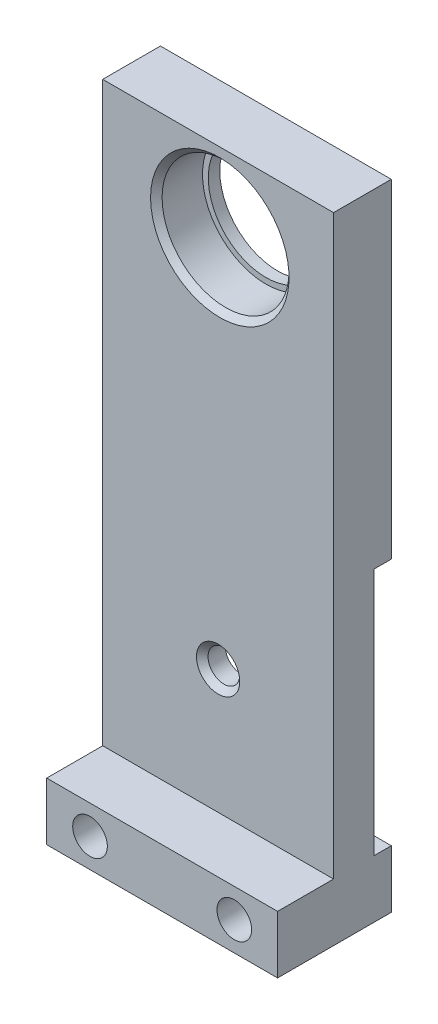
from build123d import *

# Parameters (mm, degrees)
SKIZZE1_W                       = 40
SKIZZE1_H                       = 110
AUFSATZ_LINEAR_AUSTRAGEN1_DEPTH = 10
SKIZZE2_W                       = 40
SKIZZE2_H                       = 43
SCHNITT_LINEAR_AUSTRAGEN1_DEPTH = 3
SKIZZE3_R                       = 2.75
SCHNITT_LINEAR_AUSTRAGEN2_DEPTH = 11
SKIZZE5_R                       = 11
SCHNITT_LINEAR_AUSTRAGEN4_DEPTH = 8
SKIZZE6_R                       = 10
SCHNITT_LINEAR_AUSTRAGEN5_DEPTH = 8
FASE1_SIZE                      = 1
SKIZZE10_W                      = 40
SKIZZE10_H                      = 10
AUFSATZ_LINEAR_AUSTRAGEN2_DEPTH = 9.7
SKIZZE11_R                      = 3
SCHNITT_LINEAR_AUSTRAGEN6_DEPTH = 21
SKIZZE12_R                      = 4.5
SCHNITT_LINEAR_AUSTRAGEN7_DEPTH = 13
SKIZZE13_R                      = 11.25
SCHNITT_LINEAR_AUSTRAGEN8_DEPTH = 3


with BuildPart() as part:
    # Skizze1 → Aufsatz-Linear austragen1 (new body)
    with BuildSketch(Plane.XY):
        with Locations((20, 55)):
            Rectangle(SKIZZE1_W, SKIZZE1_H)
    extrude(amount=AUFSATZ_LINEAR_AUSTRAGEN1_DEPTH)

    # Skizze2 → Schnitt-Linear austragen1 (cut)
    with BuildSketch(Plane(origin=(0, 0, 0), x_dir=(-1, 0, 0), z_dir=(0, 0, -1))):
        with Locations((-20, 31.5)):
            Rectangle(SKIZZE2_W, SKIZZE2_H)
    extrude(amount=-SCHNITT_LINEAR_AUSTRAGEN1_DEPTH, mode=Mode.SUBTRACT)

    # Skizze3 → Schnitt-Linear austragen2 (cut)
    with BuildSketch(Plane(origin=(0, 0, 3), x_dir=(-1, 0, 0), z_dir=(0, 0, -1))):
        with Locations((-20, 31.5)):
            Circle(SKIZZE3_R)
    extrude(amount=-SCHNITT_LINEAR_AUSTRAGEN2_DEPTH, mode=Mode.SUBTRACT)

    # Skizze5 → Schnitt-Linear austragen4 (cut)
    with BuildSketch(Plane.XY.offset(10)):
        with Locations((20.290455997, 96.4)):
            Circle(SKIZZE5_R)
    extrude(amount=-SCHNITT_LINEAR_AUSTRAGEN4_DEPTH, mode=Mode.SUBTRACT)

    # Skizze6 → Schnitt-Linear austragen5 (cut)
    with BuildSketch(Plane.XY.offset(2)):
        with Locations((20.290455997, 96.4)):
            Circle(SKIZZE6_R)
    extrude(amount=-SCHNITT_LINEAR_AUSTRAGEN5_DEPTH, mode=Mode.SUBTRACT)

    # Fase1
    fase1_edges = [part.edges().sort_by_distance(p)[0] for p in [
        (22.75, 31.5, 10),
        (9.290455997, 96.4, 10),
    ]]
    chamfer(fase1_edges, length=FASE1_SIZE)

    # Skizze10 → Aufsatz-Linear austragen2 (add)
    with BuildSketch(Plane.XY.offset(10)):
        with Locations((20, 5)):
            Rectangle(SKIZZE10_W, SKIZZE10_H)
    extrude(amount=AUFSATZ_LINEAR_AUSTRAGEN2_DEPTH)

    # Skizze11 → Schnitt-Linear austragen6 (cut)
    with BuildSketch(Plane(origin=(0, 0, 0), x_dir=(-1, 0, 0), z_dir=(0, 0, -1))):
        with Locations((-32.5, 5)):
            Circle(SKIZZE11_R)
        with Locations((-7.5, 5)):
            Circle(SKIZZE11_R)
    extrude(amount=-SCHNITT_LINEAR_AUSTRAGEN6_DEPTH, mode=Mode.SUBTRACT)

    # Skizze12 → Schnitt-Linear austragen7 (cut)
    with BuildSketch(Plane(origin=(0, 0, 0), x_dir=(-1, 0, 0), z_dir=(0, 0, -1))):
        with Locations((-32.5, 5)):
            Circle(SKIZZE12_R)
        with Locations((-7.5, 5)):
            Circle(SKIZZE12_R)
    extrude(amount=-SCHNITT_LINEAR_AUSTRAGEN7_DEPTH, mode=Mode.SUBTRACT)

    # Skizze13 → Schnitt-Linear austragen8 (cut)
    with BuildSketch(Plane(origin=(0, 0, 3), x_dir=(-1, 0, 0), z_dir=(0, 0, -1))):
        with Locations((-20, 31.5)):
            Circle(SKIZZE13_R)
    extrude(amount=-SCHNITT_LINEAR_AUSTRAGEN8_DEPTH, mode=Mode.SUBTRACT)


solid = part.part
